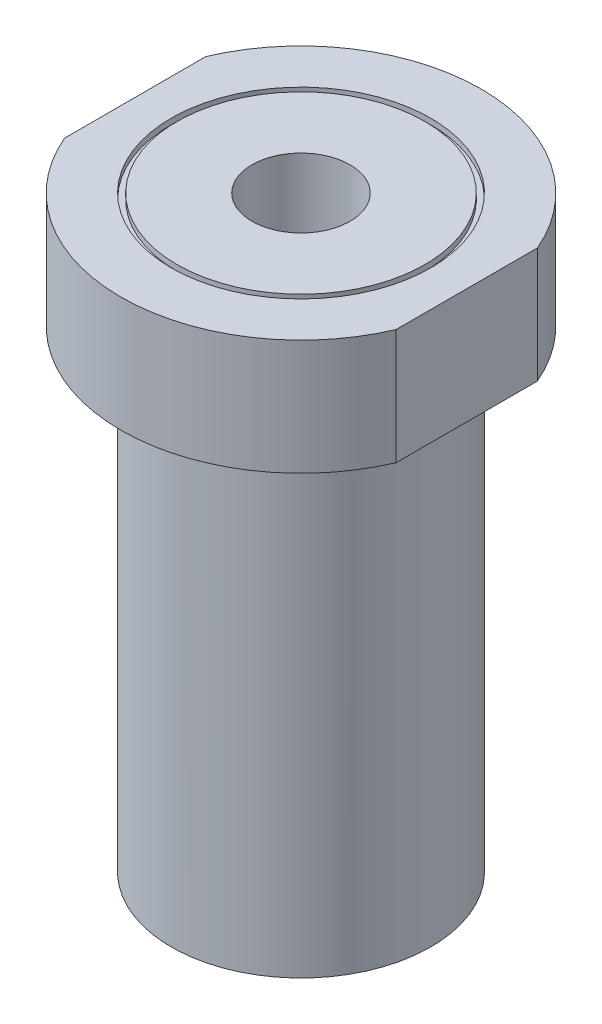
from build123d import *

# Parameters (mm, degrees)
CHAMFER_1_SIZE      = 0.5
FILLET_1_R          = 1
CUT_EXTRUDE_1_REACH = 24.233
SKETCH_3_R          = 4.5
SKETCH_3_R_2        = 4.3
CUT_EXTRUDE_2_DEPTH = 0.2


with BuildPart() as part:
    # 草图1 → 旋转1 (revolve)
    with BuildSketch(Plane(origin=(0, 0, 0), x_dir=(0, 0, -1), z_dir=(1, 0, 0)), mode=Mode.PRIVATE) as revolve_1_sk:
        Polygon((-3.65, 0), (-4.5, 0), (-4.5, 16.4), (-6.25, 16.4), (-6.25, 20.4), (-1.7, 20.4), (-1.7, 15.4), (-3.65, 15.4), align=None)
    revolve(revolve_1_sk.sketch.rotate(Axis((0, 0, 0), (0, 1, 0)), 180), axis=Axis((0, 0, 0), (0, 1, 0)))

    # 倒角1
    chamfer_1_edges = [part.edges().sort_by_distance(p)[0] for p in [
        (0, 0, 3.65),
    ]]
    chamfer(chamfer_1_edges, length=CHAMFER_1_SIZE)

    # 圆角1
    fillet_1_edges = [part.edges().sort_by_distance(p)[0] for p in [
        (0, 16.4, 4.5),
    ]]
    fillet(fillet_1_edges, radius=FILLET_1_R)

    # 草图2 → 切除-拉伸1 (cut, up to next)
    with BuildSketch(Plane(origin=(0, 20.4, 0), x_dir=(1, 0, 0), z_dir=(0, 1, 0)), mode=Mode.PRIVATE) as cut_extrude_1_sk1:
        with BuildLine():
            Line((-5.75, 2.449489743), (-5.75, -2.449489743))
            ThreePointArc((-5.75, -2.449489743), (-6.25, 0), (-5.75, 2.449489743))
        make_face()
    cut_extrude_1_tool1 = extrude(cut_extrude_1_sk1.sketch, amount=-CUT_EXTRUDE_1_REACH, mode=Mode.PRIVATE) & part.part
    # 草图2 → 切除-拉伸1 (cut, up to next)
    with BuildSketch(Plane(origin=(0, 20.4, 0), x_dir=(1, 0, 0), z_dir=(0, 1, 0)), mode=Mode.PRIVATE) as cut_extrude_1_sk2:
        with BuildLine():
            Line((5.75, 2.449489743), (5.75, -2.449489743))
            ThreePointArc((5.75, -2.449489743), (6.25, 0), (5.75, 2.449489743))
        make_face()
    cut_extrude_1_tool2 = extrude(cut_extrude_1_sk2.sketch, amount=-CUT_EXTRUDE_1_REACH, mode=Mode.PRIVATE) & part.part
    add(cut_extrude_1_tool1.solids().sort_by_distance((-5.950702, 20.4, 0))[0], mode=Mode.SUBTRACT)
    add(cut_extrude_1_tool2.solids().sort_by_distance((5.950702, 20.4, 0))[0], mode=Mode.SUBTRACT)

    # 草图3 → 切除-拉伸2 (cut)
    with BuildSketch(Plane(origin=(0, 20.4, 0), x_dir=(1, 0, 0), z_dir=(0, 1, 0))):
        with Locations(Location((0, 0, 0), (0, 0, 90))):
            Circle(SKETCH_3_R)
        with Locations(Location((0, 0, 0), (0, 0, 270))):
            Circle(SKETCH_3_R_2, mode=Mode.SUBTRACT)
    extrude(amount=-CUT_EXTRUDE_2_DEPTH, mode=Mode.SUBTRACT)


solid = part.part
